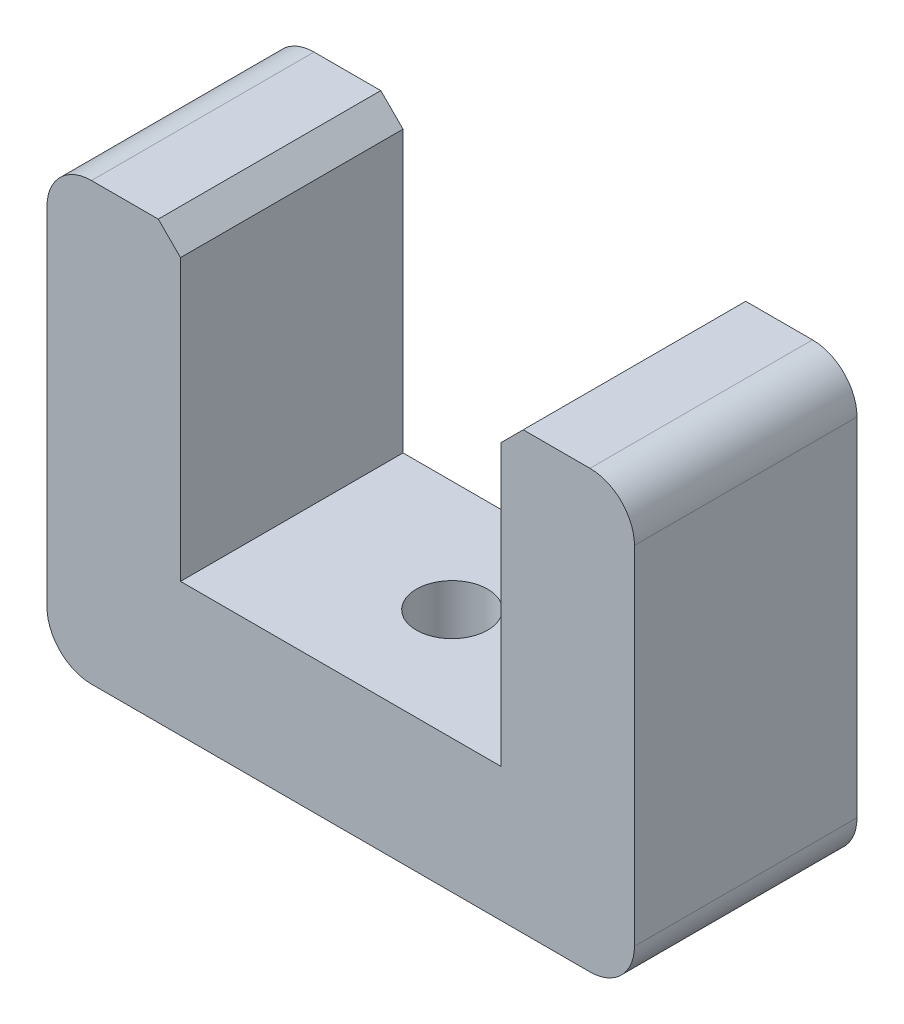
from build123d import *

# Parameters (mm, degrees)
EXTRUDE_1_DEPTH     = 5
CHAMFER_1_SIZE      = 0.5
FILLET_1_R          = 1
SKETCH_3_R          = 0.8
CUT_EXTRUDE_1_DEPTH = 4


with BuildPart() as part:
    # 草图2 → 凸台-拉伸1 (new body)
    with BuildSketch(Plane.XY):
        Polygon((-3.6, 0), (-3.6, -6.8), (3.6, -6.8), (3.6, 0), (6.6, 0), (6.6, -9.8), (-6.6, -9.8), (-6.6, 0), align=None)
    extrude(amount=EXTRUDE_1_DEPTH)

    # 倒角1
    chamfer_1_edges = [part.edges().sort_by_distance(p)[0] for p in [
        (-3.6, 0, 2.5),
        (3.6, 0, 2.5),
    ]]
    chamfer(chamfer_1_edges, length=CHAMFER_1_SIZE)

    # 圆角1
    fillet_1_edges = [part.edges().sort_by_distance(p)[0] for p in [
        (6.6, 0, 2.5),
        (6.6, -9.8, 2.5),
        (-6.6, -9.8, 2.5),
        (-6.6, 0, 2.5),
    ]]
    fillet(fillet_1_edges, radius=FILLET_1_R)

    # 草图3 → 切除-拉伸1 (cut)
    with BuildSketch(Plane(origin=(0, -6.8, 0), x_dir=(1, 0, 0), z_dir=(0, 1, 0))):
        with Locations(Location((0, -2.5, 0), (0, 0, 180))):
            Circle(SKETCH_3_R)
    extrude(amount=-CUT_EXTRUDE_1_DEPTH, mode=Mode.SUBTRACT)


solid = part.part
